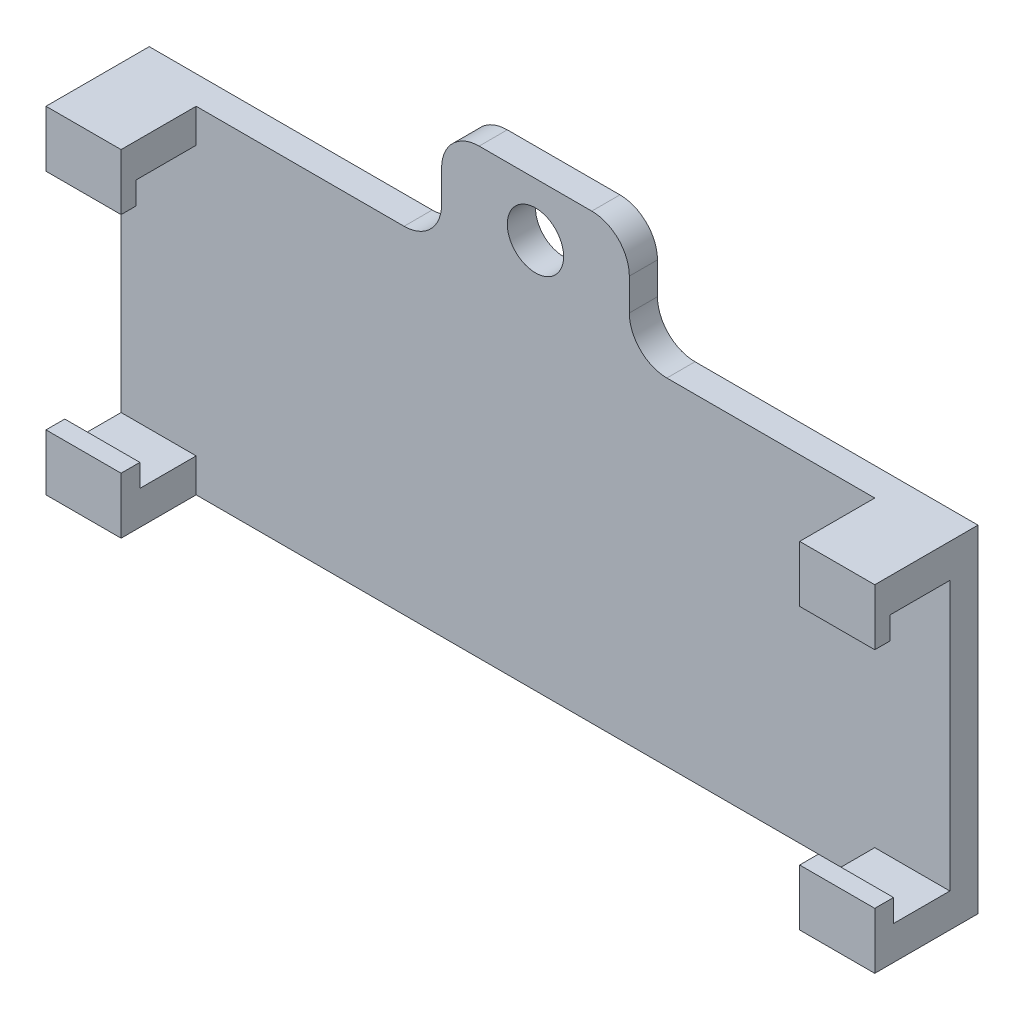
from build123d import *

# Parameters (mm, degrees)
SKETCH1_W             = 44.15
SKETCH1_H             = 29.33
BOSS_EXTRUDE1_DEPTH   = 1.5
SKETCH2_W             = 44.15
SKETCH2_H             = 3
BOSS_EXTRUDE2_DEPTH   = 4
SKETCH3_W             = 44.15
SKETCH3_H             = 3.2
CUT_EXTRUDE1_DEPTH    = 1.2
SKETCH4_W             = 44.15
SKETCH4_H             = 3
CUT_EXTRUDE2_DEPTH    = 1.2
SKETCH5_R             = 1.5
CUT_EXTRUDE3_DEPTH    = 54.155163437
SKETCH7_W             = 44.15
SKETCH7_H             = 5.7
CUT_EXTRUDE4_DEPTH    = 54.289036396
SKETCH8_W             = 36.15
SKETCH8_H             = 4
CUT_EXTRUDE5_DEPTH    = 51.377072166
SKETCH9_W             = 17.075
SKETCH9_H             = 5.7
CUT_EXTRUDE6_DEPTH    = 54.155163437
FILLET1_R             = 2
BODY_MOVE_COPY1_ANGLE = 90


with BuildPart() as part:
    # Sketch1 → Boss-Extrude1 (new body)
    with BuildSketch(Plane(origin=(0, 0, 0), x_dir=(1, 0, 0), z_dir=(0, 1, 0))):
        with Locations((22.075, 14.665)):
            Rectangle(SKETCH1_W, SKETCH1_H)
    extrude(amount=BOSS_EXTRUDE1_DEPTH)

    # Sketch2 → Boss-Extrude2 (add)
    with BuildSketch(Plane(origin=(0, 1.5, 0), x_dir=(1, 0, 0), z_dir=(0, 1, 0))):
        with Locations((22.075, 22.13)):
            Rectangle(SKETCH2_W, SKETCH2_H)
        with Locations((22.075, 7.2)):
            Rectangle(SKETCH2_W, SKETCH2_H)
    extrude(amount=BOSS_EXTRUDE2_DEPTH)

    # Sketch3 → Cut-Extrude1 (cut)
    with BuildSketch(Plane.XY.offset(-20.63)):
        with Locations((22.075, 3.1)):
            Rectangle(SKETCH3_W, SKETCH3_H)
    extrude(amount=-CUT_EXTRUDE1_DEPTH, mode=Mode.SUBTRACT)

    # Sketch4 → Cut-Extrude2 (cut)
    with BuildSketch(Plane(origin=(0, 0, -8.7), x_dir=(-1, 0, 0), z_dir=(0, 0, -1))):
        with Locations((-22.075, 3)):
            Rectangle(SKETCH4_W, SKETCH4_H)
    extrude(amount=-CUT_EXTRUDE2_DEPTH, mode=Mode.SUBTRACT)

    # Sketch5 → Cut-Extrude3 (cut, through all)
    with BuildSketch(Plane(origin=(0, 1.5, 0), x_dir=(1, 0, 0), z_dir=(0, 1, 0))):
        with Locations(Location((22.075, 26.48, 0), (0, 0, 270))):
            Circle(SKETCH5_R)
        with Locations(Location((22.075, 2.85, 0), (0, 0, 270))):
            Circle(SKETCH5_R)
    extrude(amount=-CUT_EXTRUDE3_DEPTH, mode=Mode.SUBTRACT)

    # Sketch7 → Cut-Extrude4 (cut, through all)
    with BuildSketch(Plane(origin=(0, 0, 0), x_dir=(1, 0, 0), z_dir=(0, 1, 0))):
        with Locations((22.075, 2.85)):
            Rectangle(SKETCH7_W, SKETCH7_H)
    extrude(amount=CUT_EXTRUDE4_DEPTH, mode=Mode.SUBTRACT)

    # Sketch8 → Cut-Extrude5 (cut, through all)
    with BuildSketch(Plane.XY.offset(-5.7)):
        with Locations((22.075, 3.5)):
            Rectangle(SKETCH8_W, SKETCH8_H)
    extrude(amount=-CUT_EXTRUDE5_DEPTH, mode=Mode.SUBTRACT)

    # Sketch9 → Cut-Extrude6 (cut, through all)
    with BuildSketch(Plane(origin=(0, 1.5, 0), x_dir=(1, 0, 0), z_dir=(0, 1, 0))):
        with Locations((8.5375, 26.48)):
            Rectangle(SKETCH9_W, SKETCH9_H)
        with Locations((35.6125, 26.48)):
            Rectangle(SKETCH9_W, SKETCH9_H)
    extrude(amount=-CUT_EXTRUDE6_DEPTH, mode=Mode.SUBTRACT)

    # Fillet1
    fillet1_edges = [part.edges().sort_by_distance(p)[0] for p in [
        (17.075, 0.75, -29.33),
        (17.075, 0.75, -23.63),
        (27.075, 0.75, -29.33),
        (27.075, 0.75, -23.63),
    ]]
    fillet(fillet1_edges, radius=FILLET1_R)


with BuildPart() as part_1:
    # Body-Move/Copy1: moved
    add(part.part.rotate(Axis((0, 2.75, -20.7), (1, 0, 0)), BODY_MOVE_COPY1_ANGLE))


solid = part_1.part
